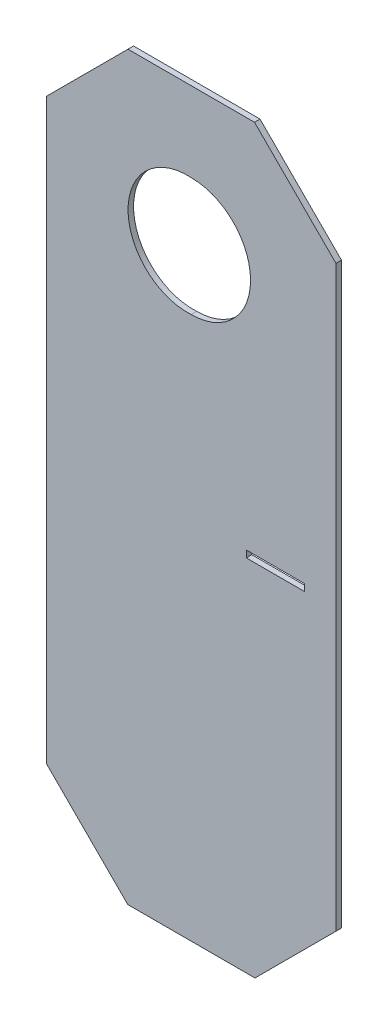
from build123d import *

# Parameters (mm, degrees)
EXTRUDE_1_DEPTH     = 4
CUT_EXTRUDE_1_DEPTH = 650.396885451
SKETCH_3_W          = 42.169531332
SKETCH_3_H          = 5.000000403
CUT_EXTRUDE_2_DEPTH = 650.396885451


with BuildPart() as part:
    # Эскиз1 → Вытянуть1 (new body)
    with BuildSketch(Plane.XY):
        Polygon((105.082921559, 581.722068254), (45.979042749, 640.825947064), (-45.813199631, 640.825947064), (-104.917078441, 581.722068254), (-104.917078441, 162.212880509), (-45.97317451, 103.268976578), (46.326817337, 103.268976578), (105.082921559, 162.0250808), align=None)
    extrude(amount=EXTRUDE_1_DEPTH)

    # Эскиз2 → Вырез-Вытянуть1 (cut, through all)
    with BuildSketch(Plane.XY.offset(4)):
        with BuildLine():
            ThreePointArc((0.117260776, 497.024602251), (43.117260776, 540.024602251), (0.117260776, 583.024602251))
            ThreePointArc((0.117260776, 583.024602251), (-45.765193681, 540.024602251), (0.117260776, 497.024602251))
        make_face()
    extrude(amount=-CUT_EXTRUDE_1_DEPTH, mode=Mode.SUBTRACT)

    # Эскиз3 → Вырез-Вытянуть2 (cut, through all)
    with BuildSketch(Plane(origin=(0, 0, 0), x_dir=(-1, 0, 0), z_dir=(0, 0, -1))):
        with Locations((-61.103979415, 366.588061036)):
            Rectangle(SKETCH_3_W, SKETCH_3_H)
    extrude(amount=-CUT_EXTRUDE_2_DEPTH, mode=Mode.SUBTRACT)


solid = part.part
